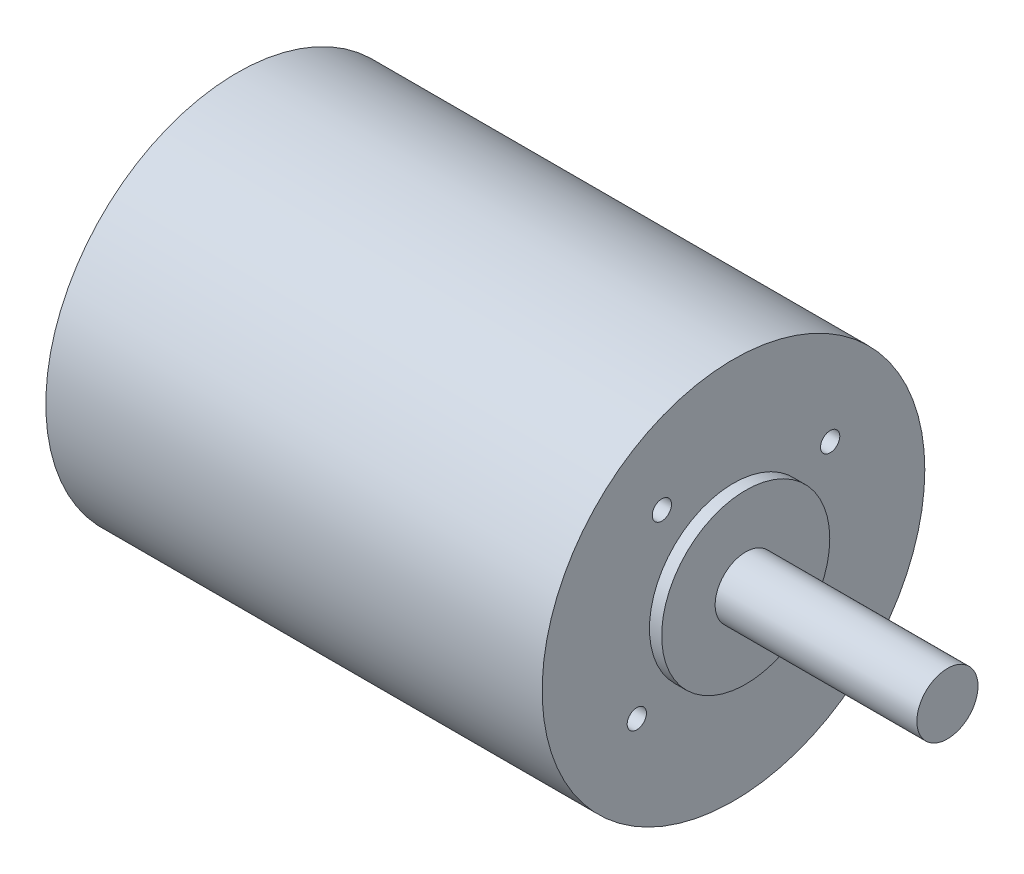
from build123d import *

# Parameters (mm, degrees)
SKETCH1_R           = 39.751
BOSS_EXTRUDE1_DEPTH = 103.124
SKETCH2_R           = 17.4625
BOSS_EXTRUDE2_DEPTH = 2.54
SKETCH3_R           = 6.35
BOSS_EXTRUDE3_DEPTH = 41.91
BOSS_EXTRUDE4_START = 14.224
SKETCH4_R           = 6.35
BOSS_EXTRUDE4_DEPTH = 14.224
SKETCH5_R           = 1.999996
CUT_EXTRUDE1_DEPTH  = 6.858


with BuildPart() as part:
    # Sketch1 → Boss-Extrude1 (new body)
    with BuildSketch(Plane(origin=(0, 0, 0), x_dir=(0, 0, -1), z_dir=(1, 0, 0))):
        Circle(SKETCH1_R)
    extrude(amount=BOSS_EXTRUDE1_DEPTH)

    # Sketch2 → Boss-Extrude2 (add)
    with BuildSketch(Plane(origin=(103.124, 0, 0), x_dir=(0, 0, -1), z_dir=(1, 0, 0))):
        Circle(SKETCH2_R)
    extrude(amount=BOSS_EXTRUDE2_DEPTH)

    # Sketch3 → Boss-Extrude3 (add)
    with BuildSketch(Plane(origin=(105.664, 0, 0), x_dir=(0, 0, -1), z_dir=(1, 0, 0))):
        Circle(SKETCH3_R)
    extrude(amount=BOSS_EXTRUDE3_DEPTH)

    # Sketch4 → Boss-Extrude4 (add)
    with BuildSketch(Plane.ZY.offset(BOSS_EXTRUDE4_START)):
        with Locations(Location((0, 0, 0), (0, 0, 180))):
            Circle(SKETCH4_R)
    extrude(amount=-BOSS_EXTRUDE4_DEPTH)

    # Sketch5 → Cut-Extrude1 (cut)
    with BuildSketch(Plane(origin=(103.124, 0, 0), x_dir=(0, 0, -1), z_dir=(1, 0, 0))):
        with Locations((-14.882420075, 20.086004442)):
            Circle(SKETCH5_R)
        with Locations((20.086004442, 14.882420075)):
            Circle(SKETCH5_R)
        with Locations((14.882420075, -20.086004442)):
            Circle(SKETCH5_R)
        with Locations((-20.086004442, -14.882420075)):
            Circle(SKETCH5_R)
    extrude(amount=-CUT_EXTRUDE1_DEPTH, mode=Mode.SUBTRACT)


solid = part.part
